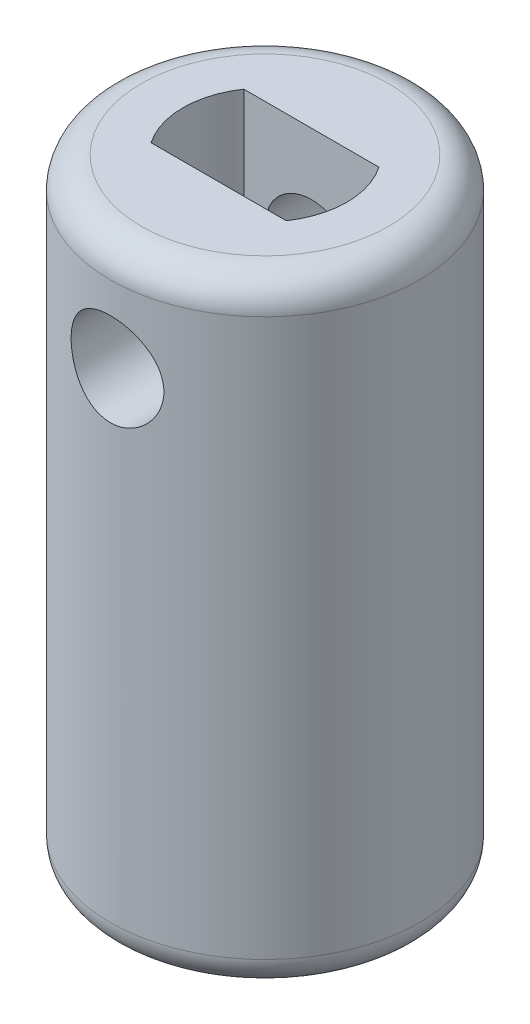
from build123d import *

# Parameters (mm, degrees)
CROQUIS1_R                 = 5
SALIENTE_EXTRUIR1_DEPTH    = 20
CORTAR_EXTRUIR1_DEPTH      = 7
CORTAR_EXTRUIR2_DEPTH      = 22.615966321
CORTAR_EXTRUIR2_DEPTH_BACK = 22.615966321
CROQUIS3_R                 = 1.5
CROQUIS4_R                 = 3.175
CORTAR_EXTRUIR3_DEPTH      = 13
REDONDEO1_R                = 1


with BuildPart() as part:
    # Croquis1 → Saliente-Extruir1 (new body)
    with BuildSketch(Plane(origin=(0, 0, 0), x_dir=(1, 0, 0), z_dir=(0, 1, 0))):
        with Locations(Location((0, 0, 0), (0, 0, 270))):
            Circle(CROQUIS1_R)
    extrude(amount=SALIENTE_EXTRUIR1_DEPTH)

    # Croquis2 → Cortar-Extruir1 (cut)
    with BuildSketch(Plane(origin=(0, 20, 0), x_dir=(1, 0, 0), z_dir=(0, 1, 0))):
        with BuildLine():
            Line((2.184605227, 1.5), (0, 1.5))
            Line((0, 1.5), (-2.184605227, 1.5))
            ThreePointArc((-2.184605227, 1.5), (-2.65, 0), (-2.184605227, -1.5))
            Line((-2.184605227, -1.5), (0, -1.5))
            Line((0, -1.5), (2.184605227, -1.5))
            ThreePointArc((2.184605227, -1.5), (2.530978452, -0.785269427), (2.65, 0))
            ThreePointArc((2.65, 0), (2.530978452, 0.785269427), (2.184605227, 1.5))
        make_face()
    extrude(amount=-CORTAR_EXTRUIR1_DEPTH, mode=Mode.SUBTRACT)

    # Croquis3 → Cortar-Extruir2 (cut, two sides: drawn at the far end of the back side and taken through both)
    with BuildSketch(Plane.XY.offset(-1.5).offset(-CORTAR_EXTRUIR2_DEPTH_BACK)):
        with Locations(Location((0, 16.5, 0), (0, 0, 90))):
            Circle(CROQUIS3_R)
    extrude(amount=CORTAR_EXTRUIR2_DEPTH + CORTAR_EXTRUIR2_DEPTH_BACK, mode=Mode.SUBTRACT)

    # Croquis4 → Cortar-Extruir3 (cut)
    with BuildSketch(Plane.XZ):
        with Locations(Location((0, 0, 0), (0, 0, 270))):
            Circle(CROQUIS4_R)
    extrude(amount=-CORTAR_EXTRUIR3_DEPTH, mode=Mode.SUBTRACT)

    # Redondeo1
    redondeo1_edges = [part.edges().sort_by_distance(p)[0] for p in [
        (0, 0, -5),
        (0, 20, -5),
    ]]
    fillet(redondeo1_edges, radius=REDONDEO1_R)


solid = part.part
